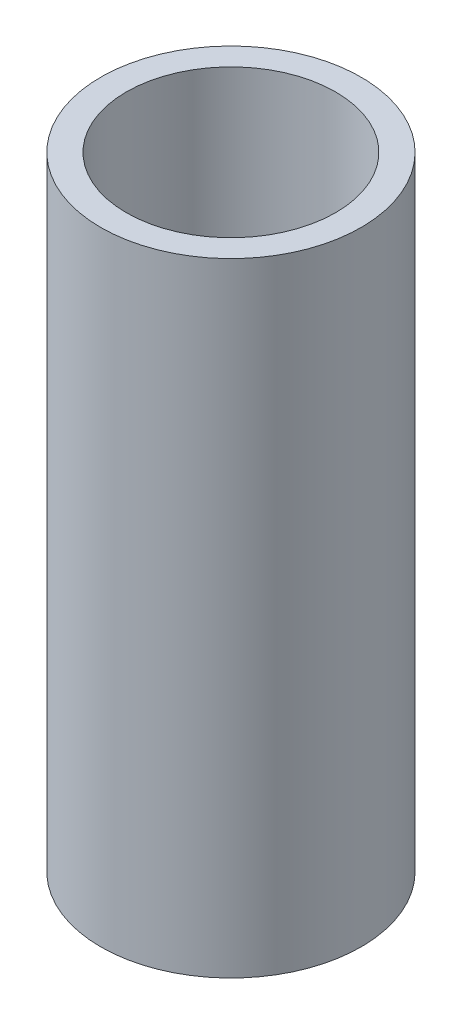
from build123d import *

# Parameters (mm, degrees)
SKETCH1_R           = 4.075
SKETCH1_R_2         = 3.275
BOSS_EXTRUDE1_DEPTH = 19.5


with BuildPart() as part:
    # Sketch1 → Boss-Extrude1 (new body)
    with BuildSketch(Plane(origin=(0, 0, 0), x_dir=(1, 0, 0), z_dir=(0, 1, 0))):
        with Locations(Location((0, 0, 0), (0, 0, 270))):
            Circle(SKETCH1_R)
        with Locations(Location((0, 0, 0), (0, 0, 270))):
            Circle(SKETCH1_R_2, mode=Mode.SUBTRACT)
    extrude(amount=BOSS_EXTRUDE1_DEPTH)


solid = part.part
